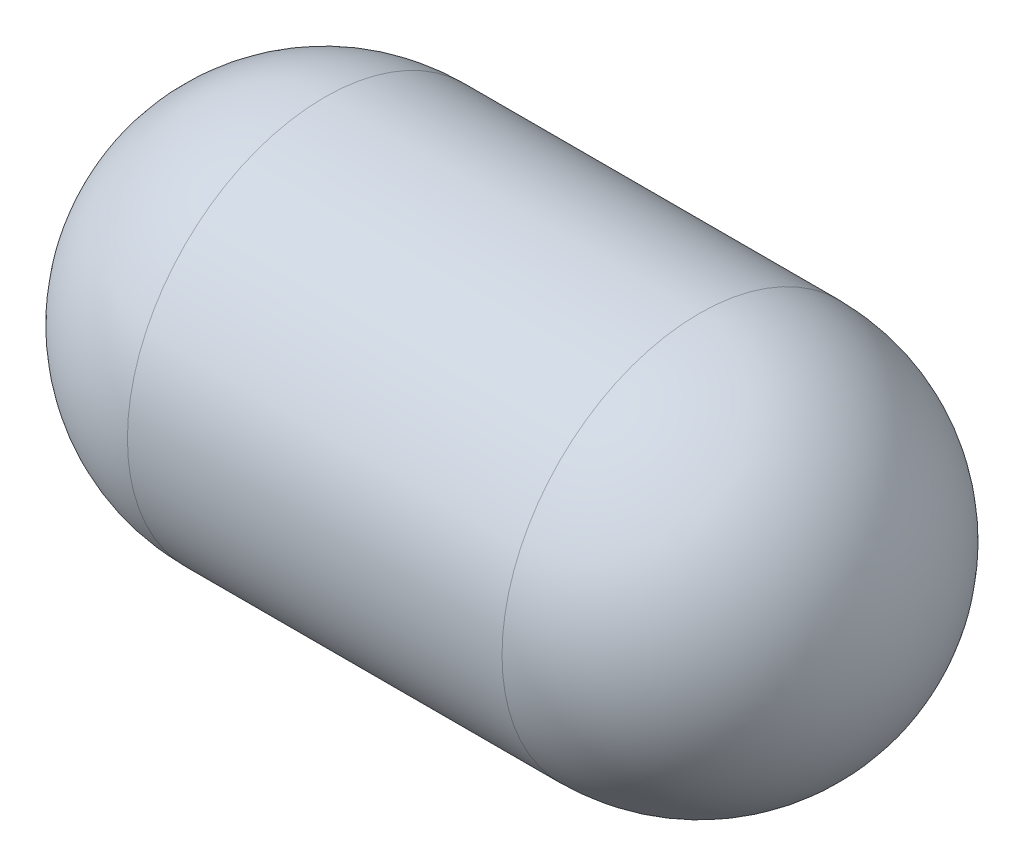
from build123d import *

# Parameters (mm, degrees)
SHELL1_T = 10


with BuildPart() as part:
    # Sketch1 → Revolve4 (revolve)
    with BuildSketch(Plane(origin=(0, 0, 0), x_dir=(1, 0, 0), z_dir=(0, 1, 0))):
        with BuildLine():
            Line((0, 200), (380, 200))
            ThreePointArc((380, 200), (521.421356237, 141.421356237), (580, 0))
            Line((580, 0), (-200, 0))
            ThreePointArc((-200, 0), (-141.421356237, 141.421356237), (0, 200))
        make_face()
    revolve(axis=Axis((-1230.065825236, 0, 0), (1, 0, 0)))

    # Shell1 (no face opened: a closed hollow body)
    add(offset(amount=-SHELL1_T, mode=Mode.PRIVATE), mode=Mode.SUBTRACT)


solid = part.part
